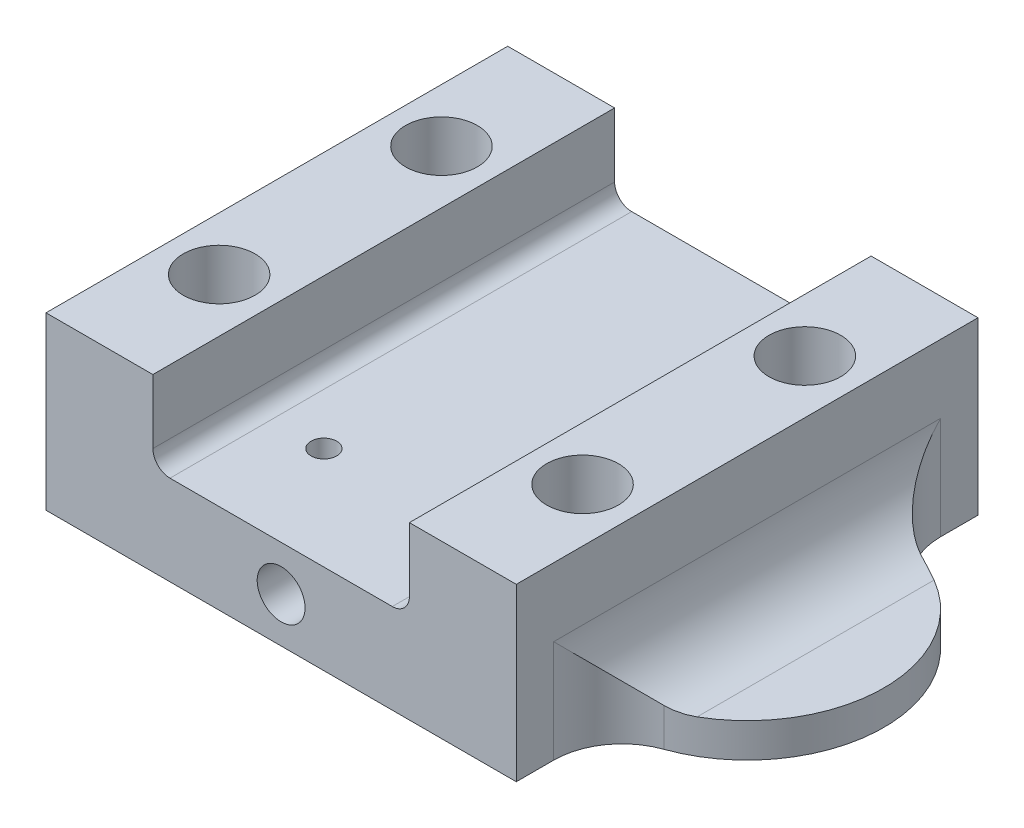
from build123d import *

# Parameters (mm, degrees)
BOSS_EXTRUDE1_DEPTH = 27
BOSS_EXTRUDE2_DEPTH = 2
SKETCH3_R           = 2.1
CUT_EXTRUDE1_DEPTH  = 37.084103148
SKETCH4_R           = 1.4
CUT_EXTRUDE2_DEPTH  = 37.084103148
FILLET1_R           = 1
FILLET2_R           = 4
SKETCH5_R           = 0.75
CUT_EXTRUDE3_DEPTH  = 36.06600926


with BuildPart() as part:
    # Sketch1 → Boss-Extrude1 (new body)
    with BuildSketch(Plane.XY):
        Polygon((7.5, -4.75), (-7.5, -4.75), (-7.5, 0), (-13.75, 0), (-13.75, -10), (13.75, -10), (13.75, 0), (7.5, 0), align=None)
    extrude(amount=BOSS_EXTRUDE1_DEPTH)

    # Sketch2 → Boss-Extrude2 (add)
    with BuildSketch(Plane.XZ.offset(10)):
        with BuildLine():
            Line((13.75, 21.5), (13.75, 5.5))
            ThreePointArc((13.75, 5.5), (21.75, 13.5), (13.75, 21.5))
        make_face()
        with BuildLine():
            Line((-13.75, 21.5), (-13.75, 5.5))
            ThreePointArc((-13.75, 5.5), (-21.75, 13.5), (-13.75, 21.5))
        make_face()
    extrude(amount=-BOSS_EXTRUDE2_DEPTH)

    # Sketch3 → Cut-Extrude1 (cut, through all)
    with BuildSketch(Plane(origin=(0, 0, 0), x_dir=(1, 0, 0), z_dir=(0, 1, 0))):
        with Locations((-10.625, -20)):
            Circle(SKETCH3_R)
        with Locations((10.625, -20)):
            Circle(SKETCH3_R)
        with Locations((10.625, -7)):
            Circle(SKETCH3_R)
        with Locations((-10.625, -7)):
            Circle(SKETCH3_R)
    extrude(amount=-CUT_EXTRUDE1_DEPTH, mode=Mode.SUBTRACT)

    # Sketch4 → Cut-Extrude2 (cut, through all)
    with BuildSketch(Plane.XY.offset(27)):
        with Locations((0, -7.375)):
            Circle(SKETCH4_R)
    extrude(amount=-CUT_EXTRUDE2_DEPTH, mode=Mode.SUBTRACT)

    # Fillet1
    fillet1_edges = [part.edges().sort_by_distance(p)[0] for p in [
        (7.5, -4.75, 13.5),
        (-7.5, -4.75, 13.5),
    ]]
    fillet(fillet1_edges, radius=FILLET1_R)

    # Fillet2
    fillet2_edges = [part.edges().sort_by_distance(p)[0] for p in [
        (13.75, -9, 5.5),
        (13.75, -8, 13.5),
        (13.75, -9, 21.5),
        (-13.75, -9, 5.5),
        (-13.75, -8, 13.5),
        (-13.75, -9, 21.5),
    ]]
    fillet(fillet2_edges, radius=FILLET2_R)

    # Sketch5 → Cut-Extrude3 (cut, through all)
    with BuildSketch(Plane(origin=(0, -4.75, 0), x_dir=(1, 0, 0), z_dir=(0, 1, 0))):
        with Locations((3.5, -6)):
            Circle(SKETCH5_R)
        with Locations((-3.5, -21)):
            Circle(SKETCH5_R)
    extrude(amount=-CUT_EXTRUDE3_DEPTH, mode=Mode.SUBTRACT)


solid = part.part
